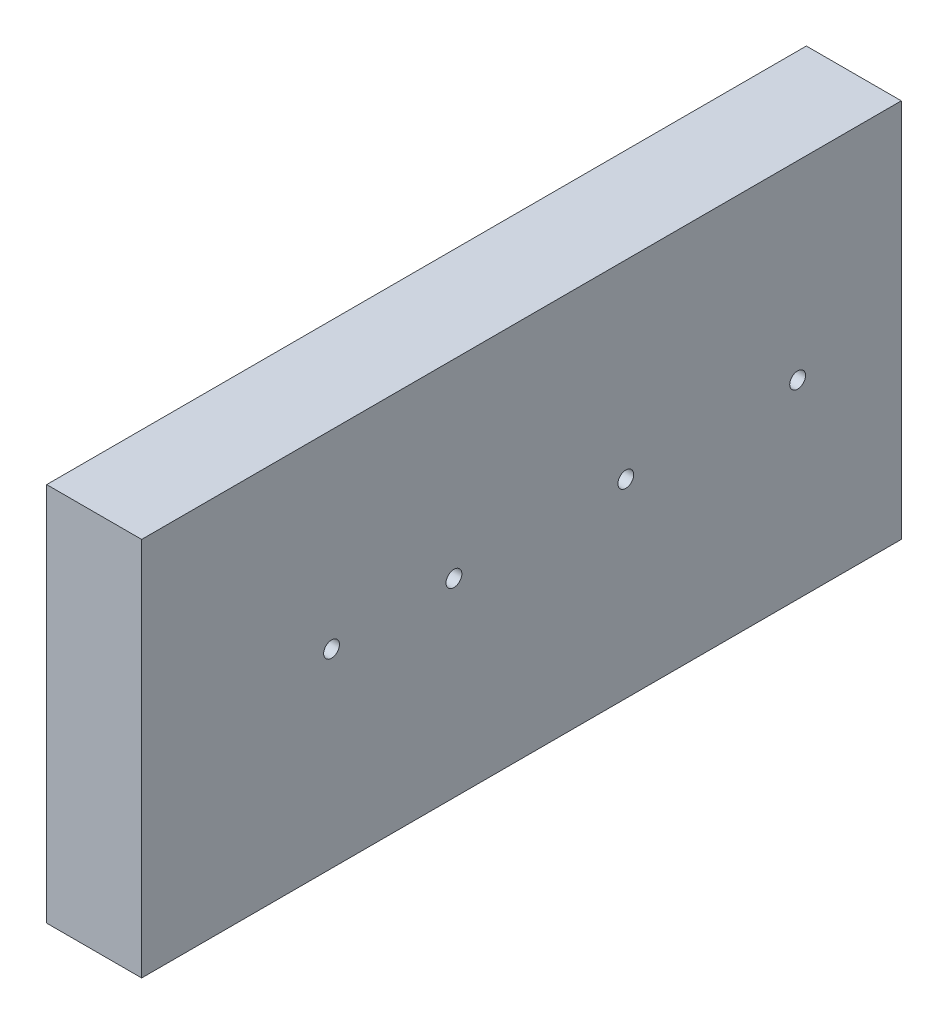
from build123d import *

# Parameters (mm, degrees)
SKETCH1_W                       = 152.4
SKETCH1_H                       = 76.2
SKETCH1_R                       = 1.5875
BOSS_EXTRUDE1_DEPTH             = 19.05
SKETCH2_R                       = 4.7625
CUT_EXTRUDE1_DEPTH              = 6.35
F_1_4_0_25_DIAMETER_HOLE1_D     = 6.35
F_1_4_0_25_DIAMETER_HOLE1_DEPTH = 12.7
F_1_4_0_25_DIAMETER_HOLE1_TIP   = 1.907732465


with BuildPart() as part:
    # Sketch1 → Boss-Extrude1 (new body)
    with BuildSketch(Plane(origin=(0, 0, 0), x_dir=(0, 0, -1), z_dir=(1, 0, 0))):
        Rectangle(SKETCH1_W, SKETCH1_H)
        with Locations((55.404, 0)):
            Circle(SKETCH1_R, mode=Mode.SUBTRACT)
        with Locations((20.927, 0)):
            Circle(SKETCH1_R, mode=Mode.SUBTRACT)
        with Locations((-13.55, 0)):
            Circle(SKETCH1_R, mode=Mode.SUBTRACT)
        with Locations((-38.1, 0)):
            Circle(SKETCH1_R, mode=Mode.SUBTRACT)
    extrude(amount=BOSS_EXTRUDE1_DEPTH)

    # Sketch2 → Cut-Extrude1 (cut)
    with BuildSketch(Plane.ZY):
        with Locations((38.1, 0)):
            Circle(SKETCH2_R)
        with Locations((13.55, 0)):
            Circle(SKETCH2_R)
        with Locations((-20.927, 0)):
            Circle(SKETCH2_R)
        with Locations((-55.404, 0)):
            Circle(SKETCH2_R)
    extrude(amount=-CUT_EXTRUDE1_DEPTH, mode=Mode.SUBTRACT)

    # 1/4 (0.25) Diameter Hole1
    with Locations(Plane.XZ.offset(38.1)):
        with Locations((9.525, -63.5), (9.525, 0), (9.525, 57.15)):
            Hole(F_1_4_0_25_DIAMETER_HOLE1_D / 2, depth=F_1_4_0_25_DIAMETER_HOLE1_DEPTH)
            with Locations((0, 0, -(F_1_4_0_25_DIAMETER_HOLE1_DEPTH + F_1_4_0_25_DIAMETER_HOLE1_TIP / 2))):  # 118° drill point
                Cone(0, F_1_4_0_25_DIAMETER_HOLE1_D / 2, F_1_4_0_25_DIAMETER_HOLE1_TIP, mode=Mode.SUBTRACT)


solid = part.part
